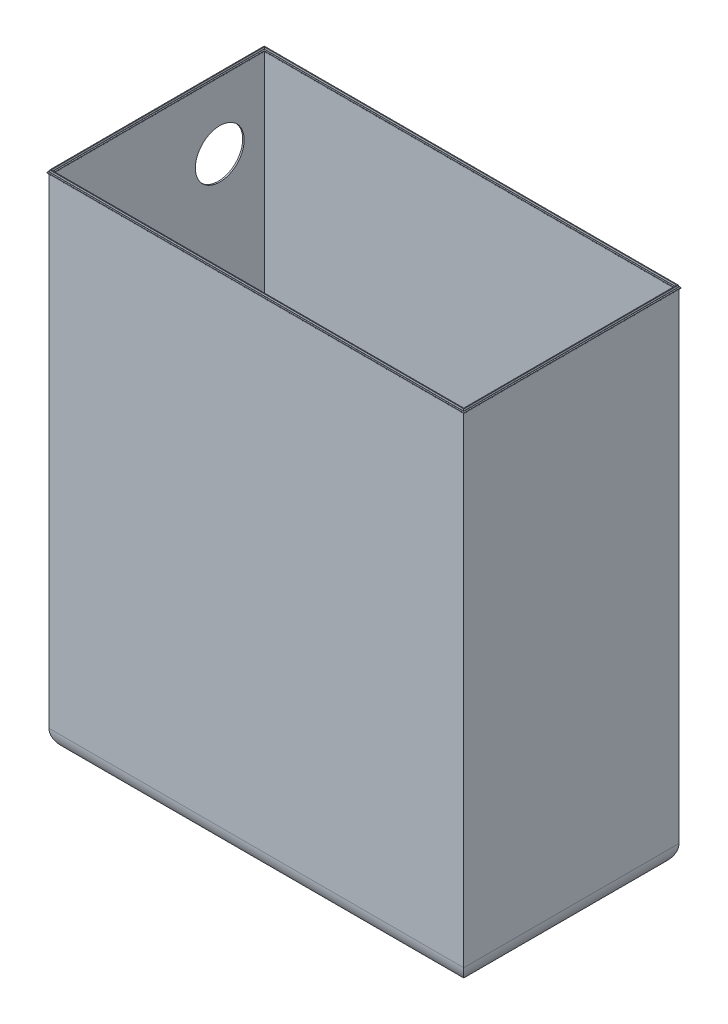
from build123d import *

# Parameters (mm, degrees)
SKETCH1_W           = 289
SKETCH1_H           = 350
BOSS_EXTRUDE1_DEPTH = 75
FILLET1_R           = 15
SHELL1_T            = -1
SKETCH5_R           = 18
CUT_EXTRUDE1_DEPTH  = 10
SKETCH6_R           = 17
CUT_EXTRUDE2_DEPTH  = 10


with BuildPart() as part:
    # Sketch1 → Boss-Extrude1 (new, symmetric)
    with BuildSketch(Plane.XY):
        with Locations((144.5, 175)):
            Rectangle(SKETCH1_W, SKETCH1_H)
    extrude(amount=BOSS_EXTRUDE1_DEPTH, both=True)

    # Fillet1
    fillet1_edges = [part.edges().sort_by_distance(p)[0] for p in [
        (144.5, 0, 75),
        (289, 0, 0),
        (0, 0, 0),
        (144.5, 0, -75),
    ]]
    fillet(fillet1_edges, radius=FILLET1_R)

    # Shell1
    shell1_openings = [part.faces().sort_by_distance(p)[0] for p in [
        (144.5, 350, 0),
    ]]
    offset(amount=SHELL1_T, openings=shell1_openings)

    # Sweep1: sweep along a path in Sketch3
    with BuildLine(Plane(origin=(0, 350, 0), x_dir=(1, 0, 0), z_dir=(0, 1, 0))) as sweep1_path:
        Line((288.5, -74.5), (288.5, 74.5))
        Line((288.5, 74.5), (0.5, 74.5))
        Line((0.5, 74.5), (0.5, -74.5))
        Line((0.5, -74.5), (288.5, -74.5))
    # Sketch4 → Sweep1 (sweep)
    with BuildSketch(Plane.XY):
        with BuildLine():
            Line((-0.65, 350), (1.65, 350))
            ThreePointArc((1.65, 350), (1.720710678, 350.029289322), (1.75, 350.1))
            Line((1.75, 350.1), (1.75, 350.4))
            ThreePointArc((1.75, 350.4), (1.720710678, 350.470710678), (1.65, 350.5))
            Line((1.65, 350.5), (0.85, 350.5))
            ThreePointArc((0.85, 350.5), (0.779289322, 350.529289322), (0.75, 350.6))
            Line((0.75, 350.6), (0.75, 351.9))
            ThreePointArc((0.75, 351.9), (0.720710678, 351.970710678), (0.65, 352))
            Line((0.65, 352), (0.35, 352))
            ThreePointArc((0.35, 352), (0.279289322, 351.970710678), (0.25, 351.9))
            Line((0.25, 351.9), (0.25, 350.6))
            ThreePointArc((0.25, 350.6), (0.220710678, 350.529289322), (0.15, 350.5))
            Line((0.15, 350.5), (-0.65, 350.5))
            ThreePointArc((-0.65, 350.5), (-0.720710678, 350.470710678), (-0.75, 350.4))
            Line((-0.75, 350.4), (-0.75, 350.1))
            ThreePointArc((-0.75, 350.1), (-0.720710678, 350.029289322), (-0.65, 350))
        make_face()
    sweep(path=sweep1_path.line, transition=Transition.RIGHT)

    # Sketch5 → Cut-Extrude1 (cut)
    with BuildSketch(Plane.XZ):
        with Locations(Location((243.128583469, 0, 0), (0, 0, 270))):
            Circle(SKETCH5_R)
    extrude(amount=-CUT_EXTRUDE1_DEPTH, mode=Mode.SUBTRACT)

    # Sketch6 → Cut-Extrude2 (cut)
    with BuildSketch(Plane.ZY):
        with Locations((-43, 303.1)):
            Circle(SKETCH6_R)
    extrude(amount=-CUT_EXTRUDE2_DEPTH, mode=Mode.SUBTRACT)


solid = part.part
